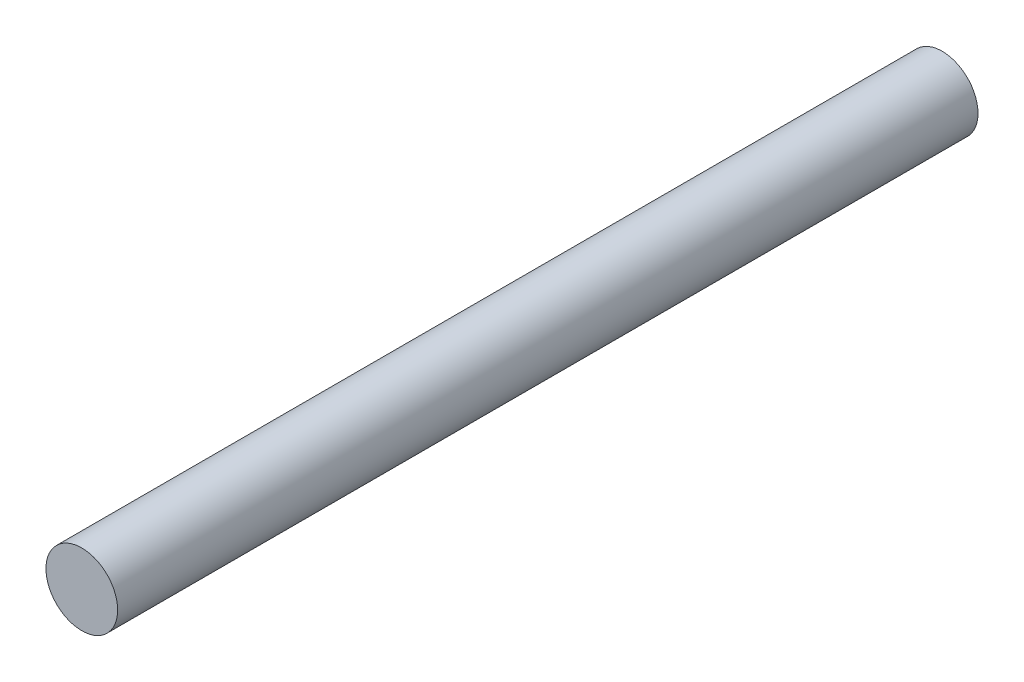
from build123d import *

# Parameters (mm, degrees)
SKETCH_1_R      = 2.5
EXTRUDE_1_DEPTH = 60


with BuildPart() as part:
    # 草图1 → 凸台-拉伸1 (new body)
    with BuildSketch(Plane.XY):
        Circle(SKETCH_1_R)
    extrude(amount=EXTRUDE_1_DEPTH)


solid = part.part
